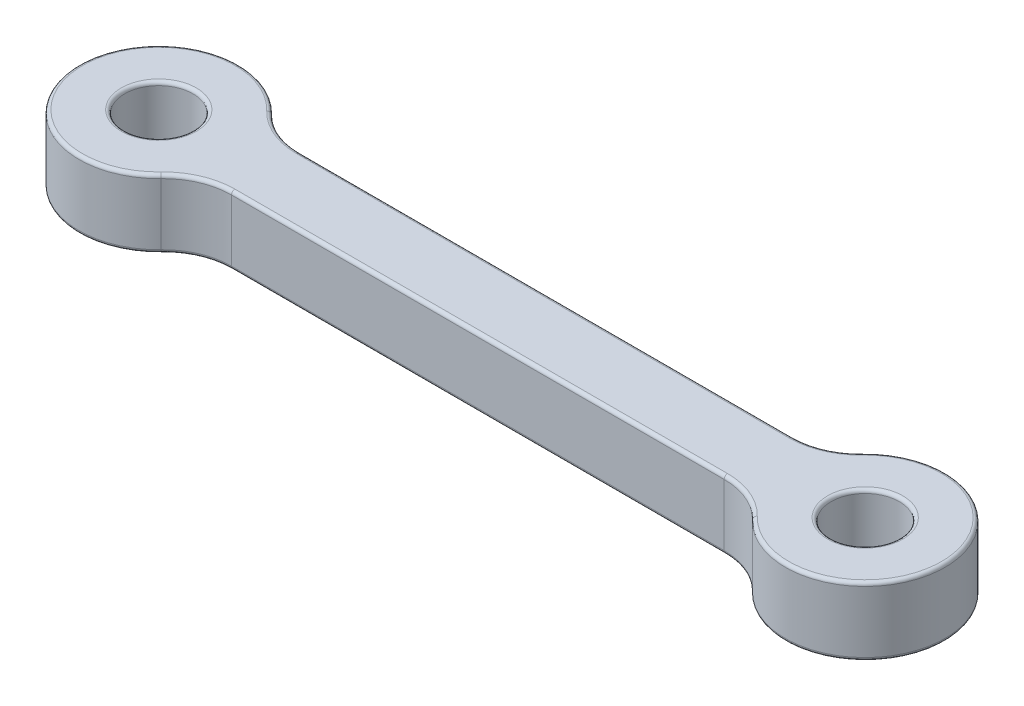
from build123d import *

# Parameters (mm, degrees)
SKETCH1_R           = 3.5
SKETCH1_R_2         = 1.5
BOSS_EXTRUDE1_DEPTH = 1.5
FILLET1_R           = 3
FILLET2_R           = 0.15


with BuildPart() as part:
    # Sketch1 → Boss-Extrude1 (new, symmetric)
    # profile 1 of 3: a face of its own
    with BuildSketch(Plane(origin=(0, 0, 0), x_dir=(1, 0, 0), z_dir=(0, 1, 0))):
        with Locations((-15.5, 0)):
            Circle(SKETCH1_R)
        with Locations(Location((-15.5, 0, 0), (0, 0, 270))):
            Circle(SKETCH1_R_2, mode=Mode.SUBTRACT)
    # profile 2 of 3: a face of its own
    with BuildSketch(Plane(origin=(0, 0, 0), x_dir=(1, 0, 0), z_dir=(0, 1, 0))):
        with BuildLine():
            ThreePointArc((12.33772234, -1.5), (12, 0), (12.33772234, 1.5))
            Line((12.33772234, 1.5), (-12.33772234, 1.5))
            ThreePointArc((-12.33772234, 1.5), (-12.085474278, 0.768774411), (-12, 0))
            ThreePointArc((-12, 0), (-12.085474278, -0.768774411), (-12.33772234, -1.5))
            Line((-12.33772234, -1.5), (12.33772234, -1.5))
        make_face()
    # profile 3 of 3: a face of its own
    with BuildSketch(Plane(origin=(0, 0, 0), x_dir=(1, 0, 0), z_dir=(0, 1, 0))):
        with Locations((15.5, 0)):
            Circle(SKETCH1_R)
        with Locations(Location((15.5, 0, 0), (0, 0, 270))):
            Circle(SKETCH1_R_2, mode=Mode.SUBTRACT)
    extrude(amount=BOSS_EXTRUDE1_DEPTH, both=True)

    # Fillet1
    fillet1_edges = [part.edges().sort_by_distance(p)[0] for p in [
        (-12.33772234, 0, -1.5),
        (12.33772234, 0, -1.5),
        (12.33772234, 0, 1.5),
        (-12.33772234, 0, 1.5),
    ]]
    fillet(fillet1_edges, radius=FILLET1_R)

    # Fillet2
    fillet2_edges = [part.edges().sort_by_distance(p)[0] for p in [
        (-15.5, -1.5, -1.5),
        (-19, -1.5, 0),
        (-19, 1.5, 0),
        (0, -1.5, -1.5),
        (0, 1.5, -1.5),
        (0, -1.5, 1.5),
        (0, 1.5, 1.5),
        (19, -1.5, 0),
        (19, 1.5, 0),
        (-11.986281051, -1.5, -1.740401367),
        (-11.986281051, 1.5, -1.740401367),
        (-11.986281051, -1.5, 1.740401367),
        (15.5, 1.5, -1.5),
        (-11.986281051, 1.5, 1.740401367),
        (11.986281051, -1.5, -1.740401367),
        (11.986281051, 1.5, -1.740401367),
        (11.986281051, -1.5, 1.740401367),
        (11.986281051, 1.5, 1.740401367),
        (-15.5, 1.5, -1.5),
        (15.5, -1.5, -1.5),
    ]]
    fillet(fillet2_edges, radius=FILLET2_R)


solid = part.part
